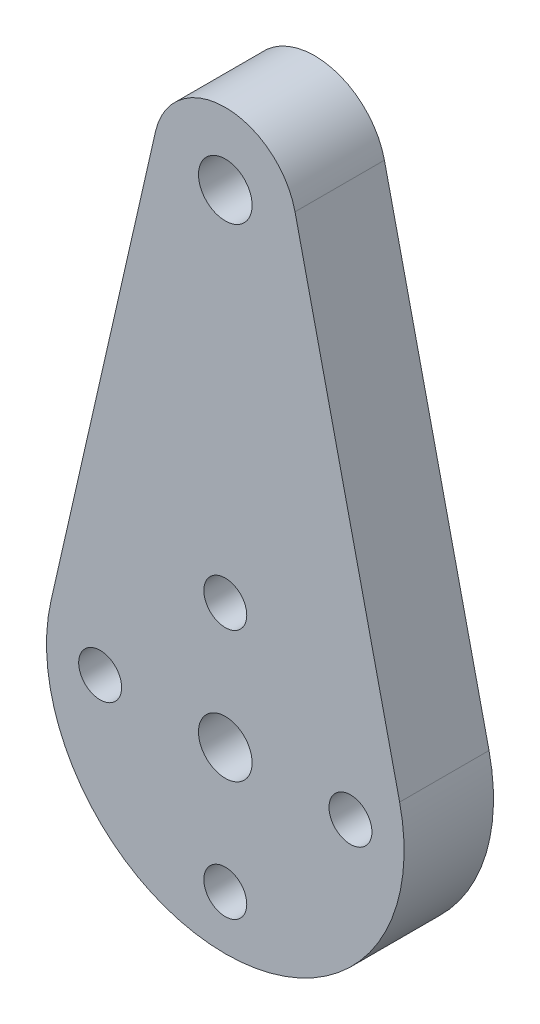
from build123d import *

# Parameters (mm, degrees)
IZIM1_R                     = 10
IZIM1_R_2                   = 1.5
IZIM1_R_3                   = 4
Y_KSEKLIK_EKSTR_ZYON1_DEPTH = 5
IZIM2_R                     = 1.2
KES_EKSTR_ZYON1_DEPTH       = 10


with BuildPart() as part:
    # Çizim1 → Yükseklik-Ekstrüzyon1 (new body)
    # profile 1 of 3: a face of its own
    with BuildSketch(Plane.XY):
        Circle(IZIM1_R)
        Circle(IZIM1_R_2, mode=Mode.SUBTRACT)
    # profile 2 of 3: a face of its own
    with BuildSketch(Plane.XY):
        with BuildLine():
            Line((-3.899984172, 27.888888889), (-9.74996043, 2.222222222))
            ThreePointArc((-9.74996043, 2.222222222), (0, 10), (9.74996043, 2.222222222))
            Line((9.74996043, 2.222222222), (3.899984172, 27.888888889))
            ThreePointArc((3.899984172, 27.888888889), (3.974917401, 27.447248986), (4, 27))
            ThreePointArc((4, 27), (-0.447248986, 23.025082599), (-3.899984172, 27.888888889))
        make_face()
    # profile 3 of 3: a face of its own
    with BuildSketch(Plane.XY):
        with Locations((0, 27)):
            Circle(IZIM1_R_3)
        with Locations((0, 27)):
            Circle(IZIM1_R_2, mode=Mode.SUBTRACT)
    extrude(amount=Y_KSEKLIK_EKSTR_ZYON1_DEPTH)

    # Çizim2 → Kes-Ekstrüzyon1 (cut)
    with BuildSketch(Plane.XY.offset(5)):
        with Locations((0, 7)):
            Circle(IZIM2_R)
        with Locations((-7, 0)):
            Circle(IZIM2_R)
        with Locations((0, -7)):
            Circle(IZIM2_R)
        with Locations((7, 0)):
            Circle(IZIM2_R)
    extrude(amount=-KES_EKSTR_ZYON1_DEPTH, mode=Mode.SUBTRACT)


solid = part.part
